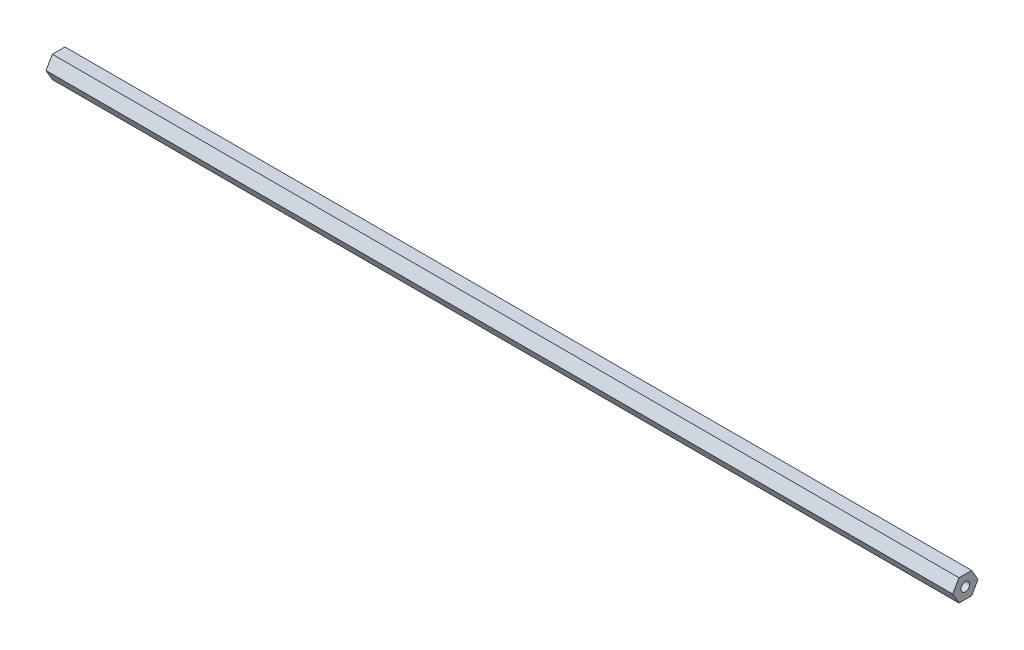
from build123d import *

# Parameters (mm, degrees)
BOSS_EXTRUDE1_DEPTH         = 525.4625
F_1_4_20_TAPPED_HOLE1_D     = 5.1054
F_1_4_20_TAPPED_HOLE1_DEPTH = 16.51
F_1_4_20_TAPPED_HOLE1_TIP   = 1.533816902
F_1_4_20_TAPPED_HOLE2_D     = 5.1054
F_1_4_20_TAPPED_HOLE2_DEPTH = 16.51
F_1_4_20_TAPPED_HOLE2_TIP   = 1.533816902


with BuildPart() as part:
    # Sketch1 → Boss-Extrude1 (new body)
    with BuildSketch(Plane(origin=(0, 0, 0), x_dir=(0, 0, -1), z_dir=(1, 0, 0))):
        Polygon((7.332348419, 0), (3.666174209, 6.35), (-3.666174209, 6.35), (-7.332348419, 0), (-3.666174209, -6.35), (3.666174209, -6.35), align=None)
    extrude(amount=BOSS_EXTRUDE1_DEPTH)

    # 1/4-20 Tapped Hole1
    with Locations(Plane(origin=(525.4625, 0, 0), x_dir=(0, 0, -1), z_dir=(1, 0, 0))):
        with Locations((0, 0)):
            Hole(F_1_4_20_TAPPED_HOLE1_D / 2, depth=F_1_4_20_TAPPED_HOLE1_DEPTH)
            with Locations((0, 0, -(F_1_4_20_TAPPED_HOLE1_DEPTH + F_1_4_20_TAPPED_HOLE1_TIP / 2))):  # 118° drill point
                Cone(0, F_1_4_20_TAPPED_HOLE1_D / 2, F_1_4_20_TAPPED_HOLE1_TIP, mode=Mode.SUBTRACT)

    # 1/4-20 Tapped Hole2
    with Locations(Plane.ZY):
        with Locations((0, 0)):
            Hole(F_1_4_20_TAPPED_HOLE2_D / 2, depth=F_1_4_20_TAPPED_HOLE2_DEPTH)
            with Locations((0, 0, -(F_1_4_20_TAPPED_HOLE2_DEPTH + F_1_4_20_TAPPED_HOLE2_TIP / 2))):  # 118° drill point
                Cone(0, F_1_4_20_TAPPED_HOLE2_D / 2, F_1_4_20_TAPPED_HOLE2_TIP, mode=Mode.SUBTRACT)


solid = part.part
